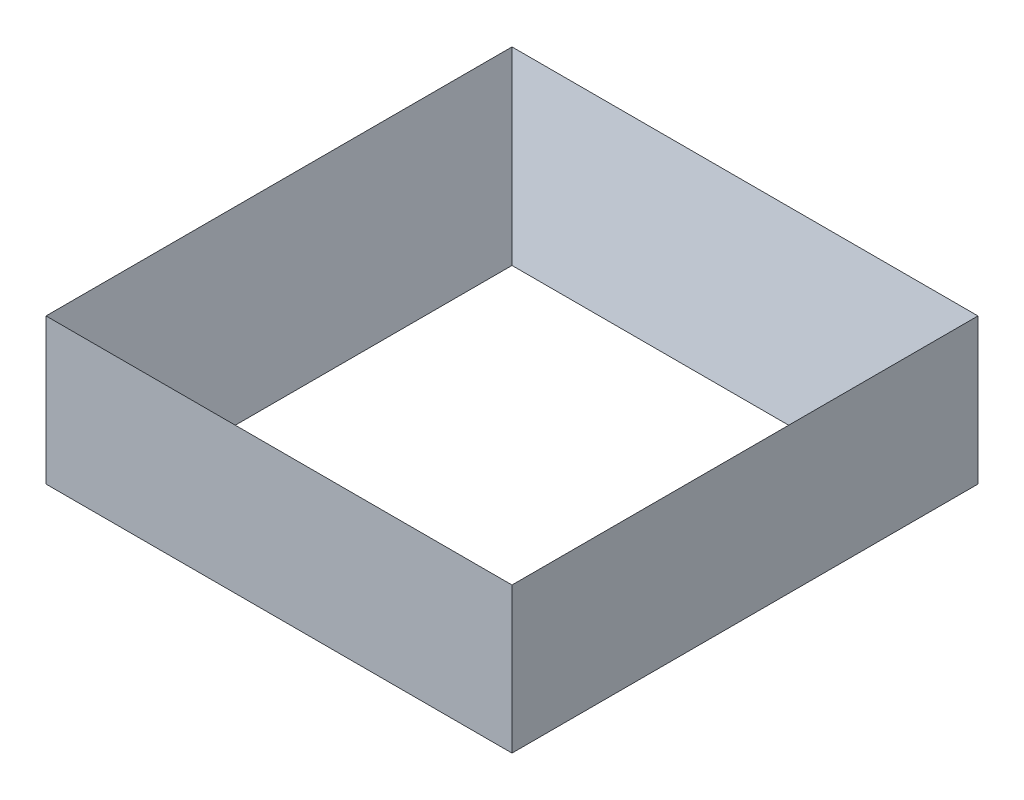
from build123d import *

# Parameters (mm, degrees)
SKETCH_1_W      = 64
SKETCH_1_H      = 64
EXTRUDE_1_DEPTH = 20


with BuildPart() as part:
    # 草图1 → 凸台-拉伸1 (new body)
    with BuildSketch(Plane(origin=(0, 0, 0), x_dir=(1, 0, 0), z_dir=(0, 1, 0))):
        with Locations((32, 32)):
            Rectangle(SKETCH_1_W, SKETCH_1_H)
    extrude(amount=EXTRUDE_1_DEPTH)

    # 草图3 → 切除-放样1 section 0
    with BuildSketch(Plane.XZ):
        with BuildLine():
            Line((6, -6), (58, -6))
            Line((58, -6), (58, -58))
            Line((58, -58), (6, -58))
            Line((6, -58), (6, -6))
        make_face()
    # 草图2 → 切除-放样1 section 1
    with BuildSketch(Plane(origin=(0, 20, 0), x_dir=(1, 0, 0), z_dir=(0, 1, 0))):
        with BuildLine():
            Line((0, 64), (0, 0))
            Line((0, 0), (64, 0))
            Line((64, 0), (64, 64))
            Line((64, 64), (0, 64))
        make_face()
    loft(mode=Mode.SUBTRACT)


solid = part.part
